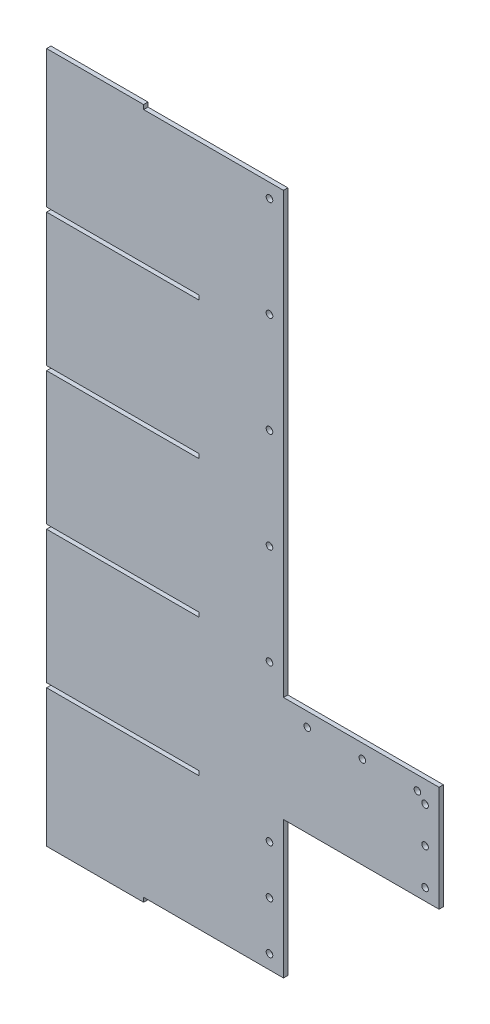
from build123d import *

# Parameters (mm, degrees)
BOSS_EXTRUDE2_DEPTH  = 3.175
BOSS_EXTRUDE3_DEPTH  = 3.175
BOSS_EXTRUDE6_DEPTH  = 3.175
SKETCH8_W            = 70.49262
SKETCH8_H            = 3.175
BOSS_EXTRUDE7_DEPTH  = 3.175
M4_CLEARANCE_HOLE2_D = 4.8


with BuildPart() as part:
    # Sketch1 → Boss-Extrude2 (new body)
    with BuildSketch(Plane.XY):
        Polygon((129.013076168, 254.245404572), (-18.685383832, 254.245404572), (-18.685383832, 157.666984572), (92.088461168, 157.666984572), (92.088461168, 154.491984572), (-18.685383832, 154.491984572), (-18.685383832, 57.913564572), (92.088461168, 57.913564572), (92.088461168, 54.738564572), (-18.685383832, 54.738564572), (-18.685383832, -41.839855428), (92.088461168, -41.839855428), (92.088461168, -45.014855428), (-18.685383832, -45.014855428), (-18.685383832, -141.593275428), (92.088461168, -141.593275428), (92.088461168, -144.768275428), (-18.685383832, -144.768275428), (-18.685383832, -241.346695428), (129.013076168, -241.346695428), align=None)
    extrude(amount=BOSS_EXTRUDE2_DEPTH)

    # Sketch2 → Boss-Extrude3 (add, through all)
    with BuildSketch(Plane.XY.offset(3.175)):
        Polygon((129.013076168, 254.245404572), (129.013076168, -241.346695428), (153.407236168, -241.346695428), (153.407236168, -227.262720585), (153.407236168, -187.892720585), (153.407236168, -143.180775428), (153.407236168, 240.16142973), (153.407236168, 254.245404572), align=None)
    extrude(amount=-BOSS_EXTRUDE3_DEPTH)

    # Sketch7 → Boss-Extrude6 (add, through all)
    with BuildSketch(Plane.XY.offset(3.175)):
        Polygon((153.22938521, -141.593275428), (153.407236168, -64.827061449), (266.437236168, -64.827061449), (266.437236168, -141.593275428), align=None)
    extrude(amount=-BOSS_EXTRUDE6_DEPTH)

    # Sketch8 → Boss-Extrude7 (add, through all)
    with BuildSketch(Plane.XY.offset(3.175)):
        with Locations((16.560926168, 255.832904572)):
            Rectangle(SKETCH8_W, SKETCH8_H)
        with Locations((16.560926168, -242.934195428)):
            Rectangle(SKETCH8_W, SKETCH8_H)
    extrude(amount=-BOSS_EXTRUDE7_DEPTH)

    # M4 Clearance Hole2 (through all)
    with Locations(Plane.XY.offset(3.175)):
        with Locations((143.247236168, 244.013297791), (143.247236168, 171.121259486), (143.247236168, 98.229221182), (143.247236168, 25.337182877), (143.247236168, -47.554855428), (170.679236168, -74.986855428), (210.711682777, -74.986855428), (250.744129387, -74.986855428), (256.277236168, -80.519962209), (256.277236168, -106.747508818), (256.277236168, -132.975055428), (143.247236168, -160.673755428), (143.247236168, -195.894172037), (143.247236168, -231.114588646)):
            Hole(M4_CLEARANCE_HOLE2_D / 2)


solid = part.part
